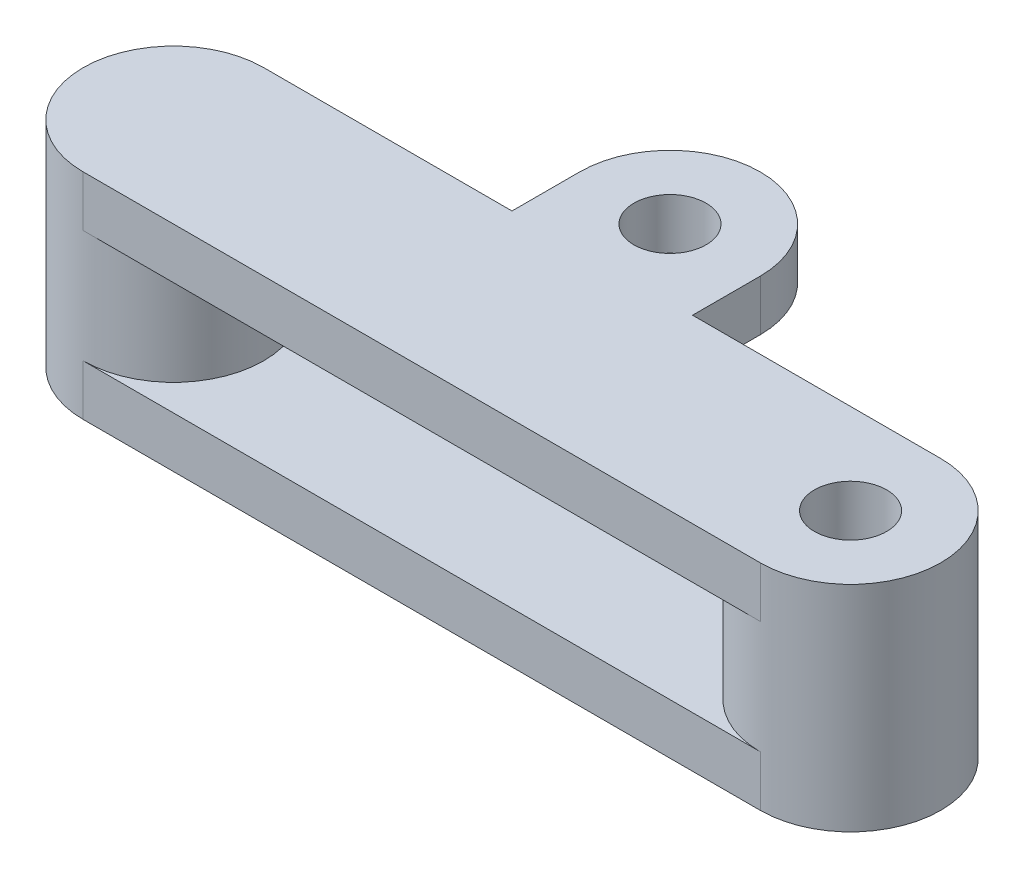
from build123d import *

# Parameters (mm, degrees)
SKETCH1_R               = 1.6
BOSS_EXTRUDE1_DEPTH     = 9.5
CUT_EXTRUDE1_DEPTH      = 2.5
CUT_EXTRUDE1_DEPTH_BACK = 2.5


with BuildPart() as part:
    # Sketch1 → Boss-Extrude1 (new body)
    with BuildSketch(Plane(origin=(0, 0, 0), x_dir=(1, 0, 0), z_dir=(0, 1, 0))):
        with BuildLine():
            Line((0, -4), (-30, -4))
            ThreePointArc((-30, -4), (-34, 0), (-30, 4))
            Line((-30, 4), (-19, 4))
            Line((-19, 4), (-19, 7))
            ThreePointArc((-19, 7), (-15, 11), (-11, 7))
            Line((-11, 7), (-11, 4))
            Line((-11, 4), (0, 4))
            ThreePointArc((0, 4), (4, 0), (0, -4))
        make_face()
        with Locations(Location((0, 0, 0), (0, 0, 270))):
            Circle(SKETCH1_R, mode=Mode.SUBTRACT)
        with Locations(Location((-15, 7, 0), (0, 0, 270))):
            Circle(SKETCH1_R, mode=Mode.SUBTRACT)
    extrude(amount=BOSS_EXTRUDE1_DEPTH)

    # Sketch2 → Cut-Extrude1 (cut, two sides: drawn at the far end of the back side and taken through both)
    with BuildSketch(Plane(origin=(0, 4.75, 0), x_dir=(1, 0, 0), z_dir=(0, 1, 0)).offset(-CUT_EXTRUDE1_DEPTH_BACK)):
        with BuildLine():
            Line((0, 4), (-11, 4))
            Line((-11, 4), (-11, 7))
            ThreePointArc((-11, 7), (-15, 11), (-19, 7))
            Line((-19, 7), (-19, 4))
            Line((-19, 4), (-30, 4))
            ThreePointArc((-30, 4), (-26, 0), (-30, -4))
            Line((-30, -4), (0, -4))
            ThreePointArc((0, -4), (-4, 0), (0, 4))
        make_face()
    extrude(amount=CUT_EXTRUDE1_DEPTH + CUT_EXTRUDE1_DEPTH_BACK, mode=Mode.SUBTRACT)


solid = part.part
